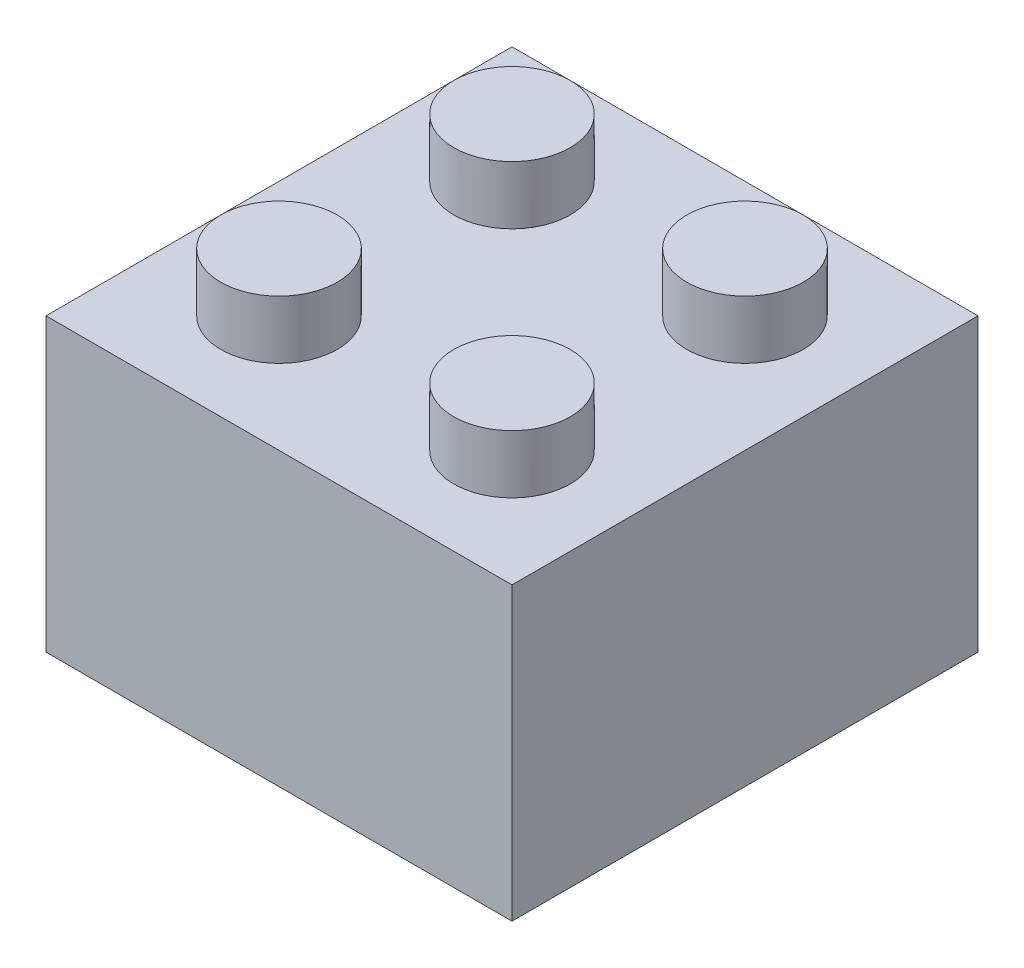
from build123d import *

# Parameters (mm, degrees)
SKETCH2_W           = 16
SKETCH2_H           = 16
BOSS_EXTRUDE1_DEPTH = 10
SKETCH3_R           = 2
BOSS_EXTRUDE2_DEPTH = 2
SHELL1_T            = -1
SKETCH4_R           = 2.7
SKETCH4_R_2         = 1.7
BOSS_EXTRUDE3_DEPTH = 9


with BuildPart() as part:
    # Sketch2 → Boss-Extrude1 (new body)
    with BuildSketch(Plane(origin=(0, 0, 0), x_dir=(1, 0, 0), z_dir=(0, 1, 0))):
        with Locations((8, 8)):
            Rectangle(SKETCH2_W, SKETCH2_H)
    extrude(amount=BOSS_EXTRUDE1_DEPTH)

    # Sketch3 → Boss-Extrude2 (add)
    with BuildSketch(Plane(origin=(0, 10, 0), x_dir=(1, 0, 0), z_dir=(0, 1, 0))):
        with Locations((4, 12)):
            Circle(SKETCH3_R)
        with Locations((12, 12)):
            Circle(SKETCH3_R)
        with Locations((12, 4)):
            Circle(SKETCH3_R)
        with Locations((4, 4)):
            Circle(SKETCH3_R)
    extrude(amount=BOSS_EXTRUDE2_DEPTH)

    # Shell1
    shell1_openings = [part.faces().sort_by_distance(p)[0] for p in [
        (8, 0, -8),
    ]]
    offset(amount=SHELL1_T, openings=shell1_openings, kind=Kind.INTERSECTION)

    # Sketch4 → Boss-Extrude3 (add)
    with BuildSketch(Plane.XZ.offset(-9)):
        with Locations((8, -8)):
            Circle(SKETCH4_R)
        with Locations((8, -8)):
            Circle(SKETCH4_R_2, mode=Mode.SUBTRACT)
    extrude(amount=BOSS_EXTRUDE3_DEPTH)


solid = part.part
